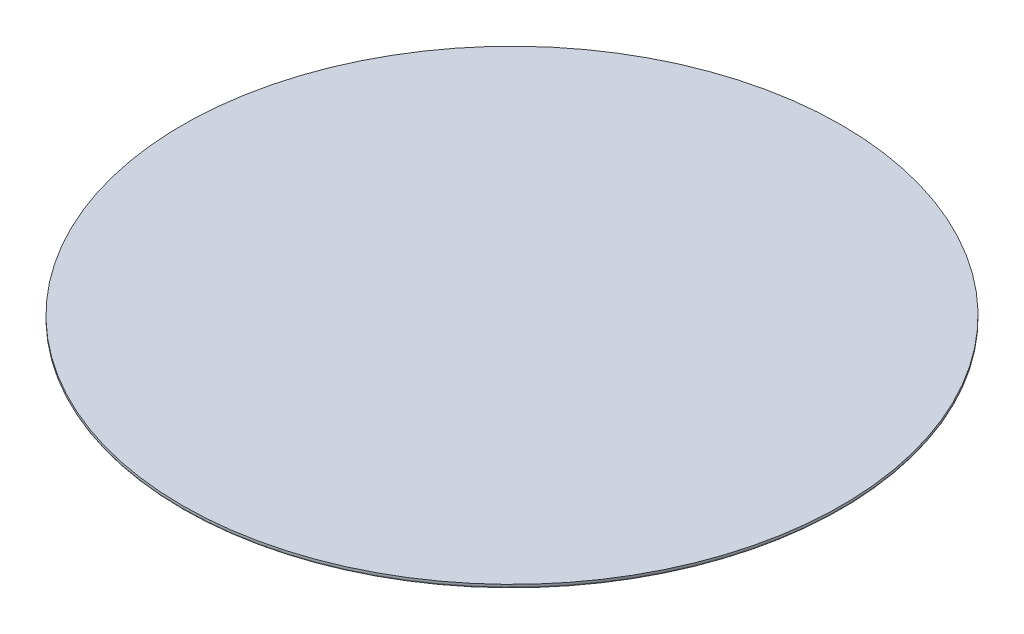
from build123d import *

# Parameters (mm, degrees)
SKETCH_1_R         = 45
EXTRUDE_1_DEPTH    = 0.5
FILLET_3_R         = 0.2
DOME_2_FACE_RADIUS = 44.8
DOME_2_HEIGHT      = 10


with BuildPart() as part:
    # Эскиз1 → Бобышка-Вытянуть1 (new body)
    with BuildSketch(Plane(origin=(0, 0, 0), x_dir=(1, 0, 0), z_dir=(0, 1, 0))):
        with Locations(Location((0, 0, 0), (0, 0, 270))):
            Circle(SKETCH_1_R)
    extrude(amount=EXTRUDE_1_DEPTH)

    # Скругление3
    fillet_3_edges = [part.edges().sort_by_distance(p)[0] for p in [
        (0, 0, -45),
    ]]
    fillet(fillet_3_edges, radius=FILLET_3_R)

    # Купол2: a dome of height H over a round flat face of radius A is a cap of a sphere of radius (A * A + H * H) / (2 * H)
    dome_2_r = (DOME_2_FACE_RADIUS * DOME_2_FACE_RADIUS + DOME_2_HEIGHT * DOME_2_HEIGHT) / (2 * DOME_2_HEIGHT)
    dome_2_base = Plane((0, 0, 0), z_dir=(0, -1, 0))
    with Locations(dome_2_base.offset(DOME_2_HEIGHT - dome_2_r)):
        dome_2_ball = Sphere(dome_2_r, mode=Mode.PRIVATE)
    add(split(dome_2_ball, bisect_by=dome_2_base, keep=Keep.TOP, mode=Mode.PRIVATE))


solid = part.part
